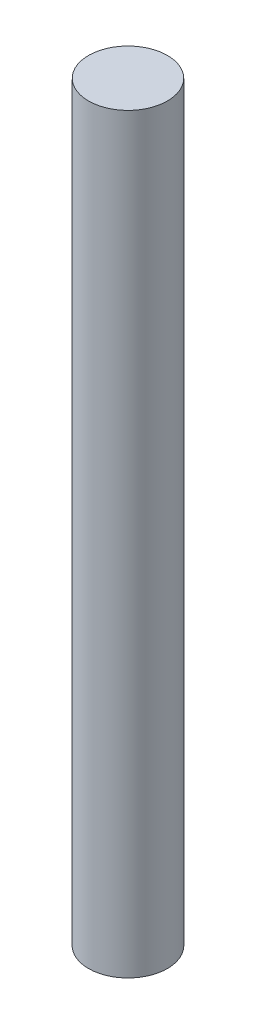
from build123d import *

# Parameters (mm, degrees)
SKETCH1_R           = 1.05
BOSS_EXTRUDE1_DEPTH = 20


with BuildPart() as part:
    # Sketch1 → Boss-Extrude1 (new body)
    with BuildSketch(Plane(origin=(0, 0, 0), x_dir=(1, 0, 0), z_dir=(0, 1, 0))):
        with Locations(Location((0, 0, 0), (0, 0, 270))):
            Circle(SKETCH1_R)
    extrude(amount=BOSS_EXTRUDE1_DEPTH)


solid = part.part
